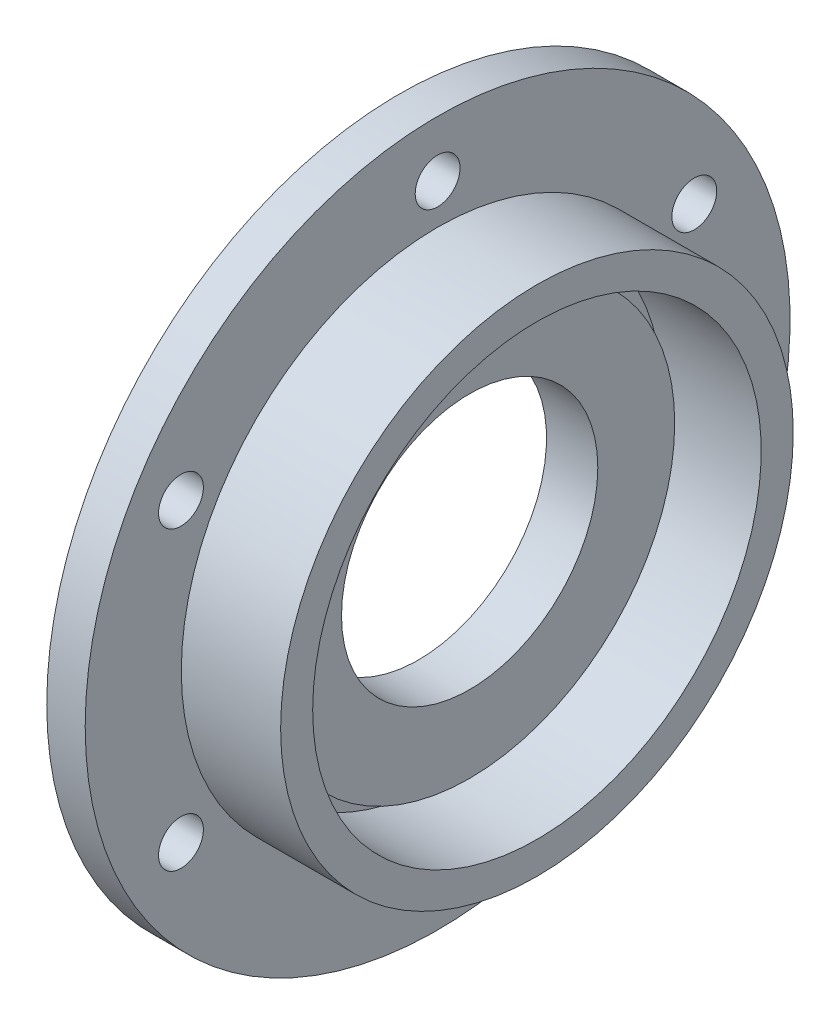
from build123d import *

# Parameters (mm, degrees)
SKETCH2_R           = 7
CUT_EXTRUDE1_DEPTH  = 12
SKETCH3_R           = 40
CUT_EXTRUDE2_DEPTH  = 6
SKETCH4_R           = 64
SKETCH4_R_2         = 40
BOSS_EXTRUDE1_DEPTH = 10


with BuildPart() as part:
    # Sketch1 → Revolve1 (revolve)
    with BuildSketch(Plane.XY, mode=Mode.PRIVATE) as revolve1_sk:
        Polygon((0, 75), (0, 110), (12, 110), (12, 80), (43, 80), (43, 70), (12, 70), (12, 0), (6, 0), (6, 75), align=None)
    revolve(revolve1_sk.sketch.rotate(Axis((0, 0, 0), (1, 0, 0)), 90), axis=Axis((0, 0, 0), (1, 0, 0)))

    # Sketch2 → Cut-Extrude1 (cut)
    with BuildSketch(Plane.ZY):
        with Locations((0, 92.5)):
            Circle(SKETCH2_R)
        with Locations((80.10734985, 46.25)):
            Circle(SKETCH2_R)
        with Locations((80.10734985, -46.25)):
            Circle(SKETCH2_R)
        with Locations((0, -92.5)):
            Circle(SKETCH2_R)
        with Locations((-80.10734985, -46.25)):
            Circle(SKETCH2_R)
        with Locations((-80.10734985, 46.25)):
            Circle(SKETCH2_R)
    extrude(amount=-CUT_EXTRUDE1_DEPTH, mode=Mode.SUBTRACT)

    # Sketch3 → Cut-Extrude2 (cut)
    with BuildSketch(Plane.ZY.offset(-6)):
        Circle(SKETCH3_R)
    extrude(amount=-CUT_EXTRUDE2_DEPTH, mode=Mode.SUBTRACT)

    # Sketch4 → Boss-Extrude1 (add)
    with BuildSketch(Plane(origin=(12, 0, 0), x_dir=(0, 0, -1), z_dir=(1, 0, 0))):
        with Locations(Location((0, 0, 0), (0, 0, 180))):
            Circle(SKETCH4_R)
        with Locations(Location((0, 0, 0), (0, 0, 180))):
            Circle(SKETCH4_R_2, mode=Mode.SUBTRACT)
    extrude(amount=BOSS_EXTRUDE1_DEPTH)


solid = part.part
